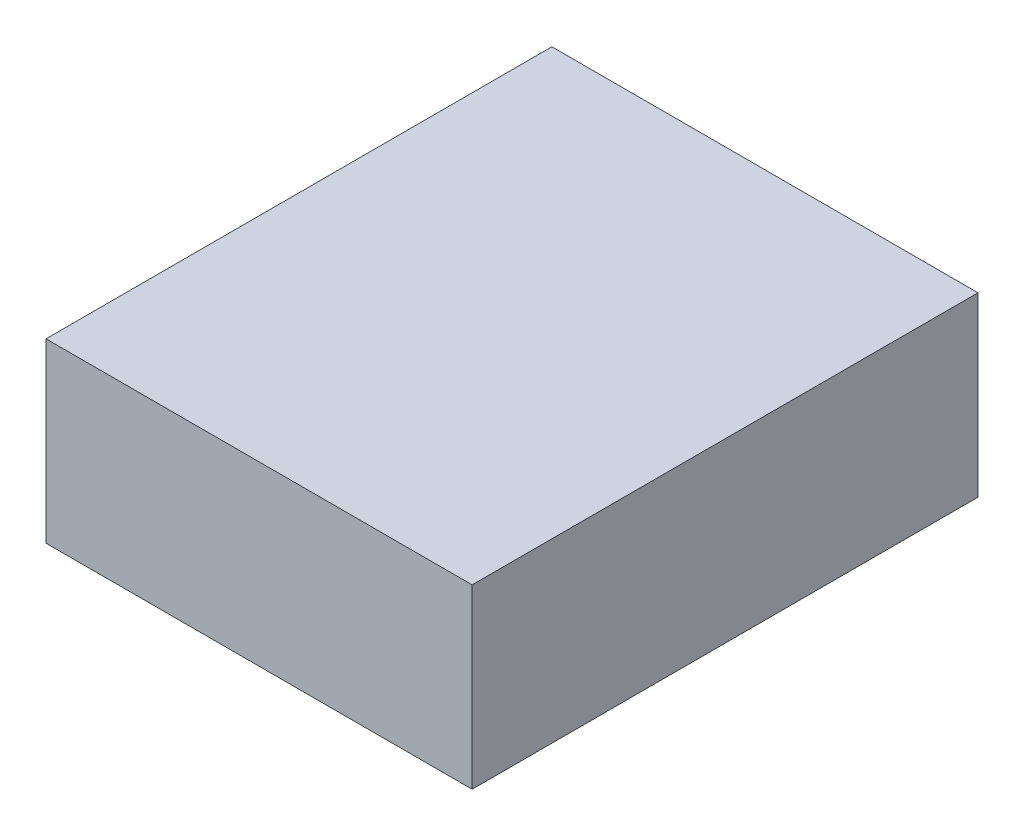
from build123d import *

# Parameters (mm, degrees)
SKETCH1_W           = 67.8688
SKETCH1_H           = 80.5688
BOSS_EXTRUDE1_DEPTH = 28.194


with BuildPart() as part:
    # Sketch1 → Boss-Extrude1 (new body)
    with BuildSketch(Plane(origin=(0, 0, 0), x_dir=(1, 0, 0), z_dir=(0, 1, 0))):
        with Locations((-33.9344, -40.2844)):
            Rectangle(SKETCH1_W, SKETCH1_H)
    extrude(amount=BOSS_EXTRUDE1_DEPTH)


solid = part.part
